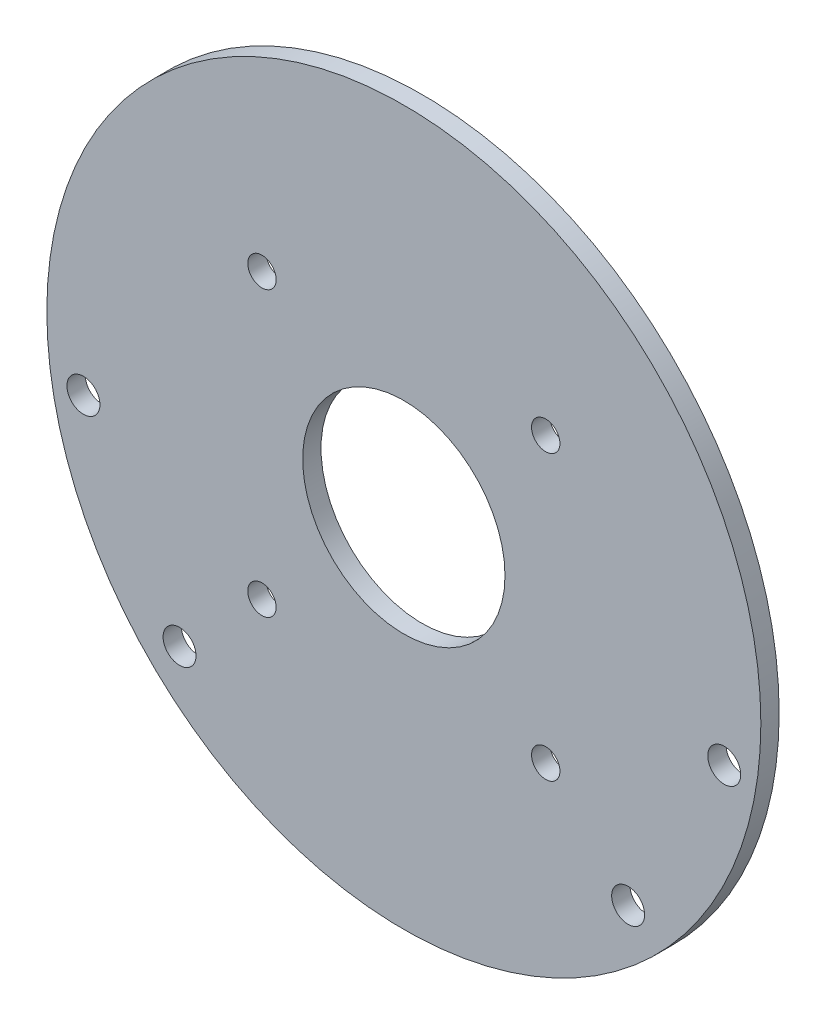
from build123d import *

# Parameters (mm, degrees)
SKETCH_1_R          = 39
EXTRUDE_1_DEPTH     = 2
SKETCH_3_R          = 1.55
CUT_EXTRUDE_2_DEPTH = 2
SKETCH_4_R          = 11.05
CUT_EXTRUDE_3_DEPTH = 2
SKETCH_6_R          = 1.8
CUT_EXTRUDE_4_DEPTH = 10


with BuildPart() as part:
    # 草图1 → 凸台-拉伸1 (new body)
    with BuildSketch(Plane.XY):
        Circle(SKETCH_1_R)
    extrude(amount=EXTRUDE_1_DEPTH)

    # 草图3 → 切除-拉伸2 (cut)
    with BuildSketch(Plane.XY.offset(2)):
        with Locations((-15.5, -15.5)):
            Circle(SKETCH_3_R)
        with Locations((15.5, -15.5)):
            Circle(SKETCH_3_R)
        with Locations((15.5, 15.5)):
            Circle(SKETCH_3_R)
        with Locations((-15.5, 15.5)):
            Circle(SKETCH_3_R)
    extrude(amount=-CUT_EXTRUDE_2_DEPTH, mode=Mode.SUBTRACT)

    # 草图4 → 切除-拉伸3 (cut)
    with BuildSketch(Plane.XY.offset(2)):
        Circle(SKETCH_4_R)
    extrude(amount=-CUT_EXTRUDE_3_DEPTH, mode=Mode.SUBTRACT)

    # 草图6 → 切除-拉伸4 (cut)
    with BuildSketch(Plane.XY.offset(2)):
        with Locations((24.5, -24.459064842)):
            Circle(SKETCH_6_R)
        with Locations((-24.5, -24.459064842)):
            Circle(SKETCH_6_R)
        with Locations((35, -5.959064842)):
            Circle(SKETCH_6_R)
        with Locations((-35, -5.959064842)):
            Circle(SKETCH_6_R)
    extrude(amount=-CUT_EXTRUDE_4_DEPTH, mode=Mode.SUBTRACT)


solid = part.part
